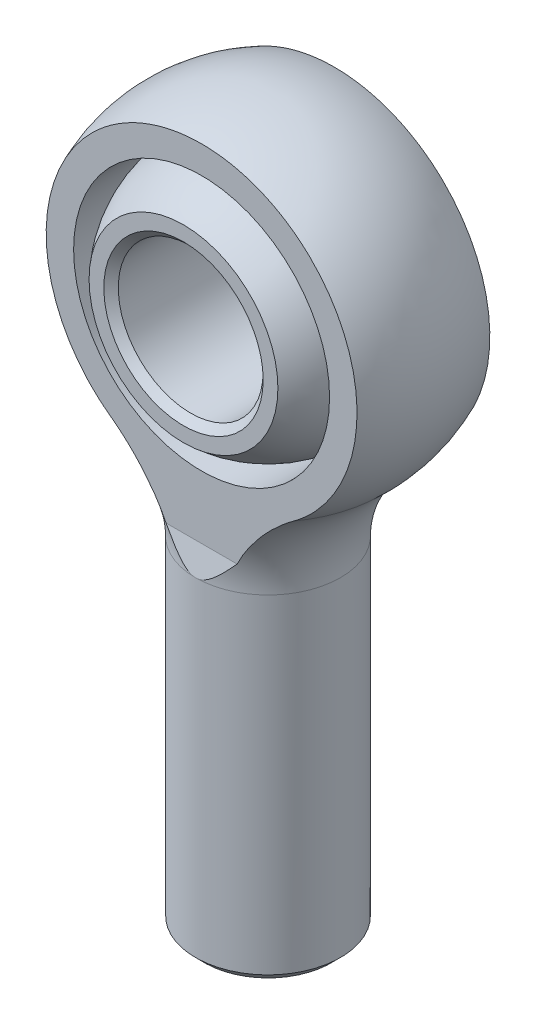
from build123d import *

# Parameters (mm, degrees)
SKETCH1_W               = 9.525
SKETCH1_H               = 44.45
CHAMFER2_SIZE           = 1.190625
CUT_EXTRUDE1_DEPTH      = 60.737268518
CUT_EXTRUDE1_DEPTH_BACK = 60.737268518
CUT_EXTRUDE2_DEPTH      = 57.261143358
CUT_EXTRUDE2_DEPTH_BACK = 57.261143358
SKETCH6_R               = 16.829024
CUT_EXTRUDE3_DEPTH      = 58.898412748
CUT_EXTRUDE3_DEPTH_BACK = 58.898412748
SKETCH8_W               = 11.1125
SKETCH8_H               = 50.8
CUT_EXTRUDE4_DEPTH      = 58.898412748
CUT_EXTRUDE4_DEPTH_BACK = 58.898412748
SKETCH10_R              = 9.525
CHAMFER1_SIZE           = 0.9525


with BuildPart() as part:
    # Sketch1 → Revolve1 (revolve)
    with BuildSketch(Plane.XY):
        with Locations((4.7625, -22.225)):
            Rectangle(SKETCH1_W, SKETCH1_H)
    revolve(axis=Axis((0, 50.8, 0), (0, -1, 0)))

    # Chamfer2
    chamfer2_edges = [part.edges().sort_by_distance(p)[0] for p in [
        (-9.525, -44.45, 0),
    ]]
    chamfer(chamfer2_edges, length=CHAMFER2_SIZE)

    # Sketch4 → Revolve2 (revolve)
    with BuildSketch(Plane.XY):
        with BuildLine():
            Line((9.525, 0), (0, 0))
            Line((0, 0), (0, 50.8))
            ThreePointArc((0, 50.8), (20.743606098, 36.553310038), (14.893041237, 12.078092784))
            ThreePointArc((14.893041237, 12.078092784), (10.927447707, 6.608634352), (9.525, 0))
        make_face()
    revolve(axis=Axis((0, 50.8, 0), (0, 1, 0)))

    # Sketch5 → Cut-Extrude1 (cut, two sides: drawn at the far end of the back side and taken through both)
    with BuildSketch(Plane(origin=(0, 0, 0), x_dir=(0, 0, -1), z_dir=(1, 0, 0)).offset(-CUT_EXTRUDE1_DEPTH_BACK)):
        Polygon((8.73125, 50.8), (22.225, 50.8), (22.225, 0), (9.525, 0), (8.73125, 3.4925), align=None)
        Polygon((-8.73125, 50.8), (-8.73125, 3.4925), (-9.525, 0), (-22.225, 0), (-22.225, 50.8), align=None)
    extrude(amount=CUT_EXTRUDE1_DEPTH + CUT_EXTRUDE1_DEPTH_BACK, mode=Mode.SUBTRACT)

    # Sketch6 → Cut-Extrude2 (cut, two sides: drawn at the far end of the back side and taken through both)
    with BuildSketch(Plane.XY.offset(-CUT_EXTRUDE2_DEPTH_BACK)):
        with Locations((0, 28.575)):
            Circle(SKETCH6_R)
    extrude(amount=CUT_EXTRUDE2_DEPTH + CUT_EXTRUDE2_DEPTH_BACK, mode=Mode.SUBTRACT)


with BuildPart() as body_2:
    # Sketch7 → Revolve3 (revolve)
    with BuildSketch(Plane.XY):
        with BuildLine():
            Line((0, 45.2374), (0, 11.9126))
            ThreePointArc((0, 11.9126), (16.6624, 28.575), (0, 45.2374))
        make_face()
    revolve(axis=Axis((0, 0, 0), (0, 1, 0)))

    # Sketch8 → Cut-Extrude3 (cut, two sides: drawn at the far end of the back side and taken through both)
    with BuildSketch(Plane(origin=(0, 0, 0), x_dir=(0, 0, -1), z_dir=(1, 0, 0)).offset(-CUT_EXTRUDE3_DEPTH_BACK)):
        with Locations((-16.66875, 25.4)):
            Rectangle(SKETCH8_W, SKETCH8_H)
        with Locations((16.66875, 25.4)):
            Rectangle(SKETCH8_W, SKETCH8_H)
    extrude(amount=CUT_EXTRUDE3_DEPTH + CUT_EXTRUDE3_DEPTH_BACK, mode=Mode.SUBTRACT)

    # Sketch10 → Cut-Extrude4 (cut, two sides: drawn at the far end of the back side and taken through both)
    with BuildSketch(Plane.XY.offset(-CUT_EXTRUDE4_DEPTH_BACK)):
        with Locations((0, 28.575)):
            Circle(SKETCH10_R)
    extrude(amount=CUT_EXTRUDE4_DEPTH + CUT_EXTRUDE4_DEPTH_BACK, mode=Mode.SUBTRACT)

    # Chamfer1
    chamfer1_edges = [body_2.edges().sort_by_distance(p)[0] for p in [
        (-9.525, 28.575, -11.1125),
        (-9.525, 28.575, 11.1125),
    ]]
    chamfer(chamfer1_edges, length=CHAMFER1_SIZE)


solid = Compound([part.part, body_2.part])
